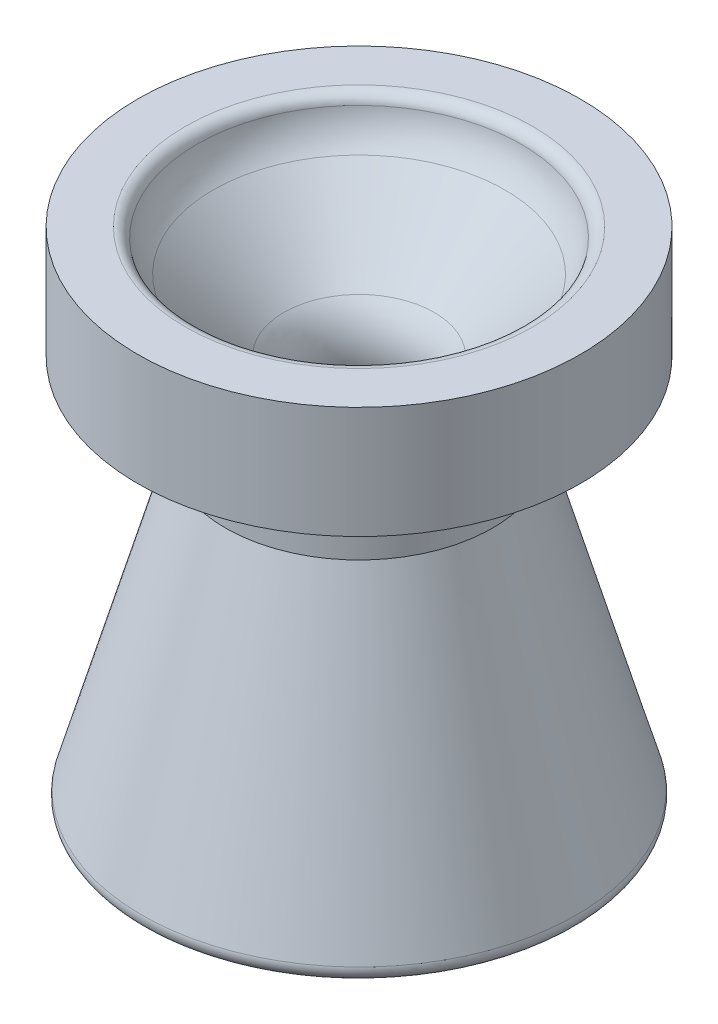
from build123d import *

# Parameters (mm, degrees)
FILLET1_R = 1.27


with BuildPart() as part:
    # Sketch2 → Revolve1 (revolve)
    with BuildSketch(Plane.XY):
        with BuildLine():
            Line((4.490128061, 4.490128061), (-3.220128061, 12.200384182))
            ThreePointArc((-3.220128061, 12.200384182), (-4.596635031, 14.260472447), (-5.08, 16.690512242))
            Line((-5.08, 16.690512242), (-11.43, 16.690512242))
            Line((-11.43, 16.690512242), (-11.43, 4.490128061))
            Line((-11.43, 4.490128061), (-1.859871939, 4.490128061))
            Line((-1.859871939, 4.490128061), (-1.859871939, -4.490128061))
            Line((-1.859871939, -4.490128061), (-11.43, -38.1))
            Line((-11.43, -38.1), (-5.08, -38.1))
            add(Edge.make_bspline(
                [(-5.08, -38.1), (-5.08, -14.060256121), (4.490128061, -4.490128061)],
                knots=[0, 0, 0, 1, 1, 1], degree=2))
            ThreePointArc((4.490128061, -4.490128061), (6.35, 0), (4.490128061, 4.490128061))
        make_face()
    revolve(axis=Axis((12.7, 19.649377631, 0), (0, -1, 0)))

    # Fillet1
    fillet1_edges = [part.edges().sort_by_distance(p)[0] for p in [
        (36.83, -38.1, 0),
        (30.48, 16.690512242, 0),
    ]]
    fillet(fillet1_edges, radius=FILLET1_R)


solid = part.part
